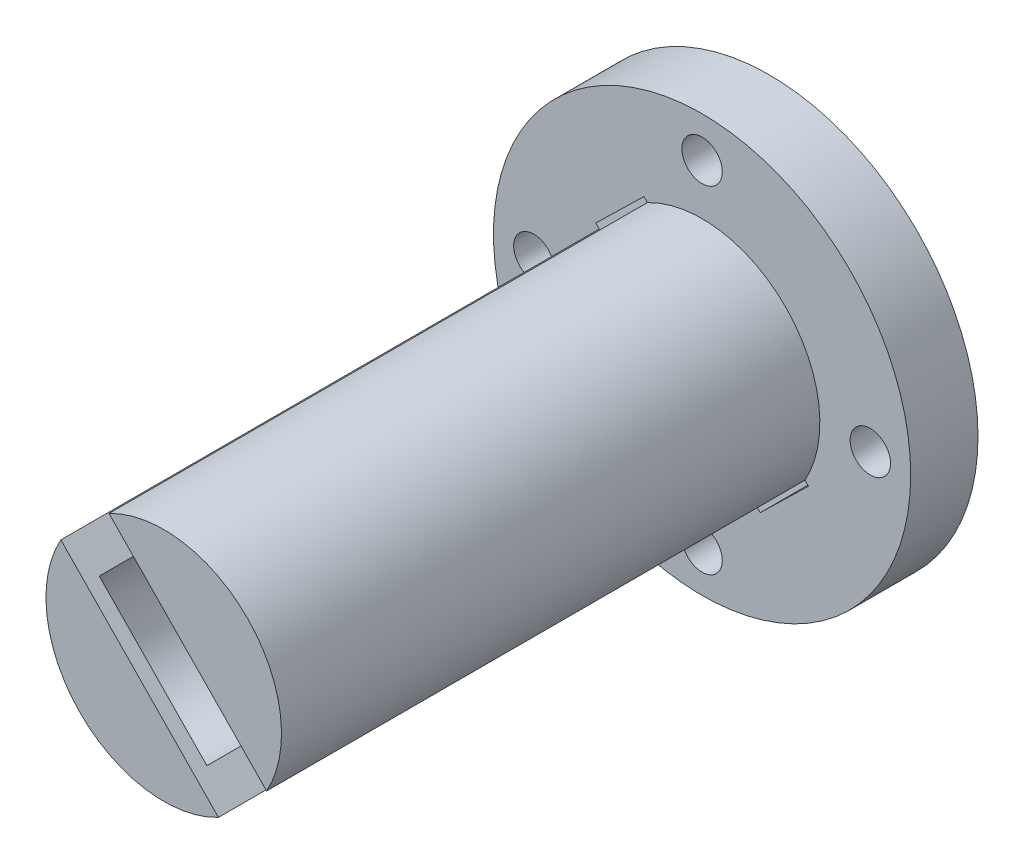
from build123d import *

# Parameters (mm, degrees)
SKETCH_5_R           = 31
EXTRUDE_4_DEPTH      = 10
SKETCH_6_R           = 3
CUT_EXTRUDE_5_DEPTH  = 10
SKETCH_8_R           = 17.5
EXTRUDE_5_DEPTH      = 90
SKETCH_4_R           = 12.5
CUT_EXTRUDE_6_DEPTH  = 88
CUT_EXTRUDE_10_DEPTH = 120


with BuildPart() as part:
    # Эскиз5 → Бобышка-Вытянуть4 (new body)
    with BuildSketch(Plane.XY):
        Circle(SKETCH_5_R)
    extrude(amount=EXTRUDE_4_DEPTH)

    # Эскиз6 → Вырез-Вытянуть5 (cut)
    with BuildSketch(Plane.XY):
        with Locations((0, -25)):
            Circle(SKETCH_6_R)
        with Locations((-25, 0)):
            Circle(SKETCH_6_R)
        with Locations((0, 25)):
            Circle(SKETCH_6_R)
        with Locations((25, 0)):
            Circle(SKETCH_6_R)
    extrude(amount=CUT_EXTRUDE_5_DEPTH, mode=Mode.SUBTRACT)

    # Эскиз8 → Бобышка-Вытянуть5 (add)
    with BuildSketch(Plane.XY):
        Circle(SKETCH_8_R)
    extrude(amount=EXTRUDE_5_DEPTH)

    # Эскиз4 → Вырез-Вытянуть6 (cut)
    with BuildSketch(Plane.XY):
        Circle(SKETCH_4_R)
    extrude(amount=CUT_EXTRUDE_6_DEPTH, mode=Mode.SUBTRACT)

    # Эскиз12 → Вырез-Вытянуть10 (cut)
    with BuildSketch(Plane.XY):
        Polygon((8.640186366, -16.018650991), (-15.798690834, 9.036114648), (-8.640186366, 16.018650991), (15.798690834, -9.036114648), align=None)
    extrude(amount=CUT_EXTRUDE_10_DEPTH, mode=Mode.SUBTRACT)


solid = part.part
